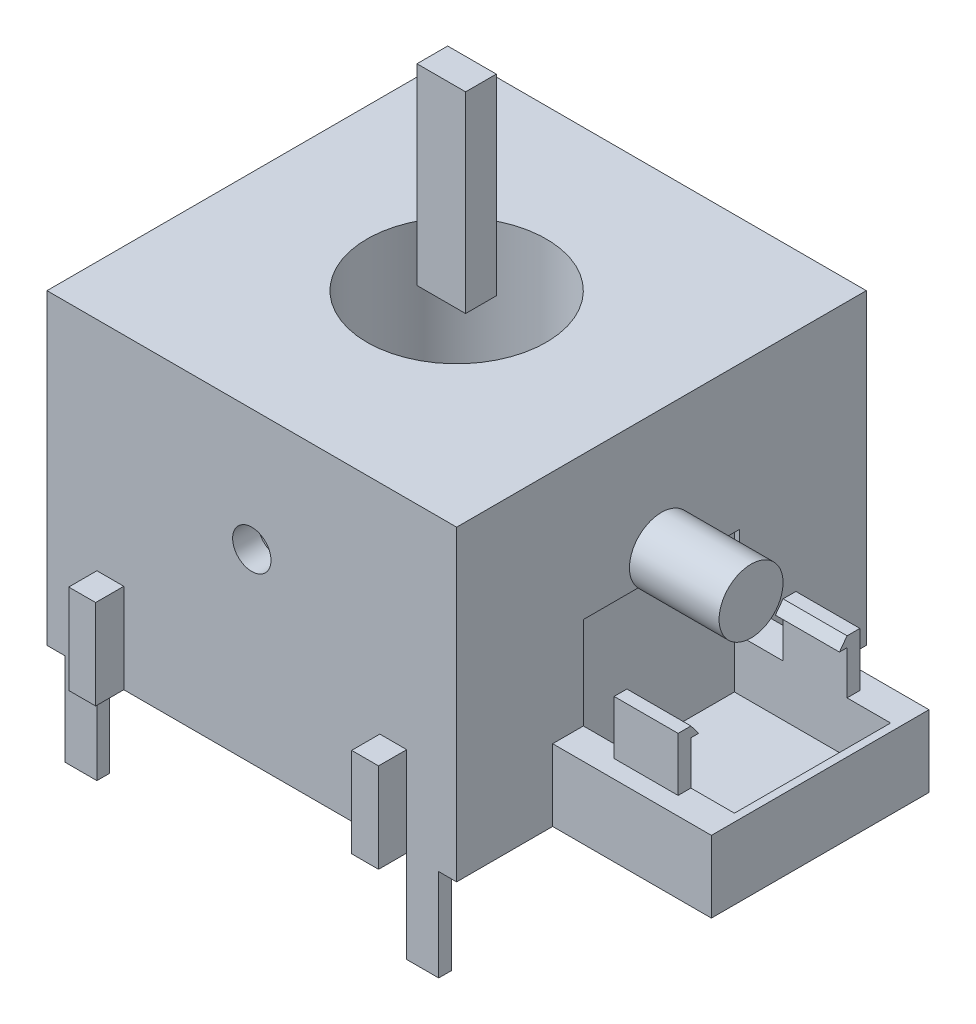
from build123d import *

# Parameters (mm, degrees)
ESQUISSE1_W                  = 16
ESQUISSE1_H                  = 16
ESQUISSE1_R                  = 3.5
BOSS_EXTRU_1_DEPTH           = 12
ESQUISSE2_W                  = 1.25
ESQUISSE2_H                  = 0.5
BOSS_EXTRU_2_DEPTH           = 3.6
ESQUISSE5_R                  = 0.75
ENL_V_MAT_EXTRU_2_DEPTH      = 1
ESQUISSE6_W                  = 6.2
ESQUISSE6_H                  = 8.5
BOSS_EXTRU_4_DEPTH           = 2.8
ENL_V_MAT_EXTRU_3_DEPTH      = 3.6
ENL_V_MAT_EXTRU_3_DEPTH_BACK = 2
ESQUISSE7_W                  = 6.1
ESQUISSE7_H                  = 6.1
ESQUISSE3_R                  = 1.25
BOSS_EXTRU_3_DEPTH           = 3.5
BOSS_EXTRU_5_START           = -2
BOSS_EXTRU_5_DEPTH           = 2.5
ESQUISSE10_W                 = 1.05
ESQUISSE10_H                 = 3.5
BOSS_EXTRU_6_DEPTH           = 1.1
ESQUISSE11_W                 = 1.9
ESQUISSE11_H                 = 1.2
BOSS_EXTRU_7_DEPTH           = 7.5


with BuildPart() as part:
    # Esquisse1 → Boss.-Extru.1 (new body)
    with BuildSketch(Plane(origin=(0, 0, 0), x_dir=(1, 0, 0), z_dir=(0, 1, 0))):
        Rectangle(ESQUISSE1_W, ESQUISSE1_H)
        with Locations(Location((0, 0, 0), (0, 0, 270))):
            Circle(ESQUISSE1_R, mode=Mode.SUBTRACT)
    extrude(amount=BOSS_EXTRU_1_DEPTH)

    # Esquisse2 → Boss.-Extru.2 (add)
    with BuildSketch(Plane.XZ):
        with Locations((-6.675, 7.75)):
            Rectangle(ESQUISSE2_W, ESQUISSE2_H)
        with Locations((6.675, 7.75)):
            Rectangle(ESQUISSE2_W, ESQUISSE2_H)
        with Locations((6.675, -7.75)):
            Rectangle(ESQUISSE2_W, ESQUISSE2_H)
        with Locations((-6.675, -7.75)):
            Rectangle(ESQUISSE2_W, ESQUISSE2_H)
    extrude(amount=BOSS_EXTRU_2_DEPTH)

    # Esquisse5 → Enlèv. mat.-Extru.2 (cut)
    with BuildSketch(Plane.XY.offset(8)):
        with Locations((0, 7.25)):
            Circle(ESQUISSE5_R)
    extrude(amount=-ENL_V_MAT_EXTRU_2_DEPTH, mode=Mode.SUBTRACT)

    # Esquisse6 → Boss.-Extru.4 (add)
    with BuildSketch(Plane.XZ):
        with Locations((11.1, 0)):
            Rectangle(ESQUISSE6_W, ESQUISSE6_H)
    extrude(amount=-BOSS_EXTRU_4_DEPTH)

    # Esquisse7 → Enlèv. mat.-Extru.3 (cut, two sides: drawn at the far end of the back side and taken through both)
    with BuildSketch(Plane(origin=(0, 2.8, 0), x_dir=(1, 0, 0), z_dir=(0, 1, 0)).offset(-ENL_V_MAT_EXTRU_3_DEPTH_BACK)):
        with Locations((10.85, 0)):
            Rectangle(ESQUISSE7_W, ESQUISSE7_H)
    extrude(amount=ENL_V_MAT_EXTRU_3_DEPTH + ENL_V_MAT_EXTRU_3_DEPTH_BACK, mode=Mode.SUBTRACT)

    # Esquisse3 → Boss.-Extru.3 (add)
    with BuildSketch(Plane.ZY.offset(-8)):
        with Locations((0, 7.25)):
            Circle(ESQUISSE3_R)
    extrude(amount=-BOSS_EXTRU_3_DEPTH)

    # Esquisse9 → Boss.-Extru.5 (add)
    with BuildSketch(Plane(origin=(14.2, 0, 0), x_dir=(0, 0, -1), z_dir=(1, 0, 0)).offset(BOSS_EXTRU_5_START)):
        Polygon((-3.05, 2.8), (-3.05, 4.5), (-2.75, 4.5), (-3.05, 4.9), (-3.55, 4.9), (-3.55, 2.8), align=None)
    boss_extru_5 = extrude(amount=-BOSS_EXTRU_5_DEPTH)

    # Symétrie1: Boss.-Extru.5 across plane
    add(boss_extru_5.mirror(Plane.XY))

    # Esquisse10 → Boss.-Extru.6 (add)
    with BuildSketch(Plane.XY.offset(8)):
        with Locations((-5.525, 1.75)):
            Rectangle(ESQUISSE10_W, ESQUISSE10_H)
        with Locations((5.525, 1.75)):
            Rectangle(ESQUISSE10_W, ESQUISSE10_H)
    extrude(amount=BOSS_EXTRU_6_DEPTH)


with BuildPart() as body_2:
    # Esquisse11 → Boss.-Extru.7 (new body)
    with BuildSketch(Plane(origin=(0, 12, 0), x_dir=(1, 0, 0), z_dir=(0, 1, 0))):
        Rectangle(ESQUISSE11_W, ESQUISSE11_H)
    extrude(amount=BOSS_EXTRU_7_DEPTH)


solid = Compound([part.part, body_2.part])
